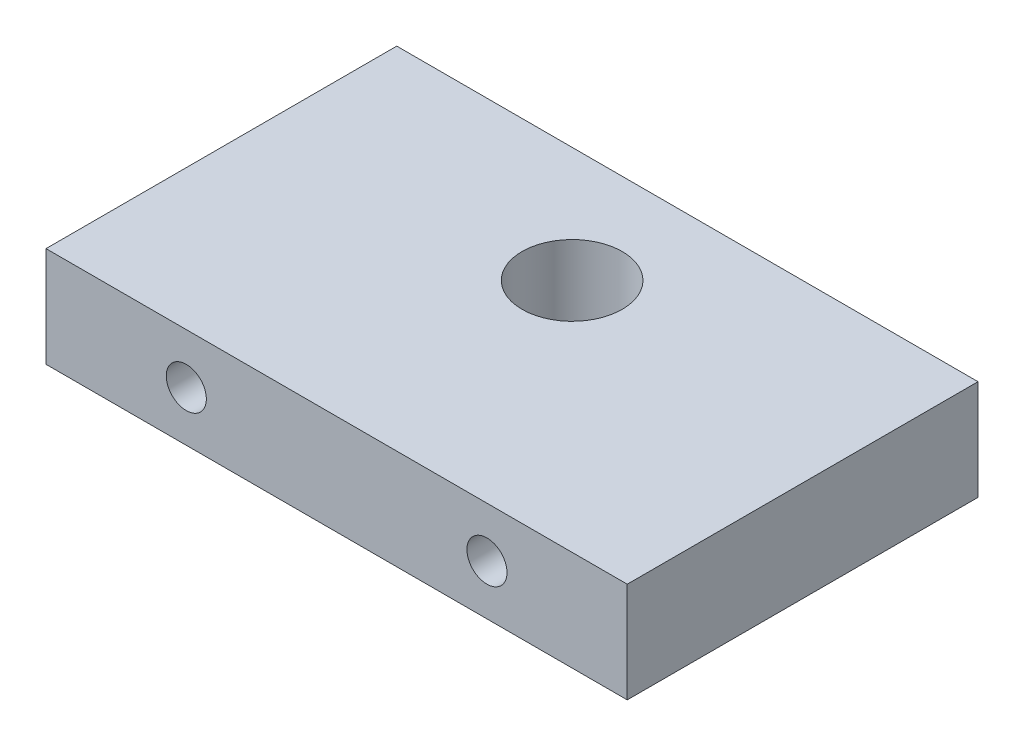
from build123d import *

# Parameters (mm, degrees)
SKETCH1_W           = 58
SKETCH1_H           = 10
SKETCH1_R           = 2
BOSS_EXTRUDE1_DEPTH = 45
SKETCH3_W           = 58
SKETCH3_H           = 10
CUT_EXTRUDE3_DEPTH  = 10
SKETCH4_R           = 5
CUT_EXTRUDE4_DEPTH  = 10


with BuildPart() as part:
    # Sketch1 → Boss-Extrude1 (new body)
    with BuildSketch(Plane.XY):
        with Locations((29, -5)):
            Rectangle(SKETCH1_W, SKETCH1_H)
        with Locations(Location((14, -5, 0), (0, 0, 180))):
            Circle(SKETCH1_R, mode=Mode.SUBTRACT)
        with Locations(Location((44, -5, 0), (0, 0, 180))):
            Circle(SKETCH1_R, mode=Mode.SUBTRACT)
    extrude(amount=BOSS_EXTRUDE1_DEPTH)

    # Sketch3 → Cut-Extrude3 (cut)
    with BuildSketch(Plane(origin=(0, 0, 0), x_dir=(-1, 0, 0), z_dir=(0, 0, -1))):
        with Locations((-29, -5)):
            Rectangle(SKETCH3_W, SKETCH3_H)
    extrude(amount=-CUT_EXTRUDE3_DEPTH, mode=Mode.SUBTRACT)

    # Sketch4 → Cut-Extrude4 (cut)
    with BuildSketch(Plane(origin=(0, 0, 0), x_dir=(1, 0, 0), z_dir=(0, 1, 0))):
        with Locations(Location((29, -21.5, 0), (0, 0, 270))):
            Circle(SKETCH4_R)
    extrude(amount=-CUT_EXTRUDE4_DEPTH, mode=Mode.SUBTRACT)


solid = part.part
